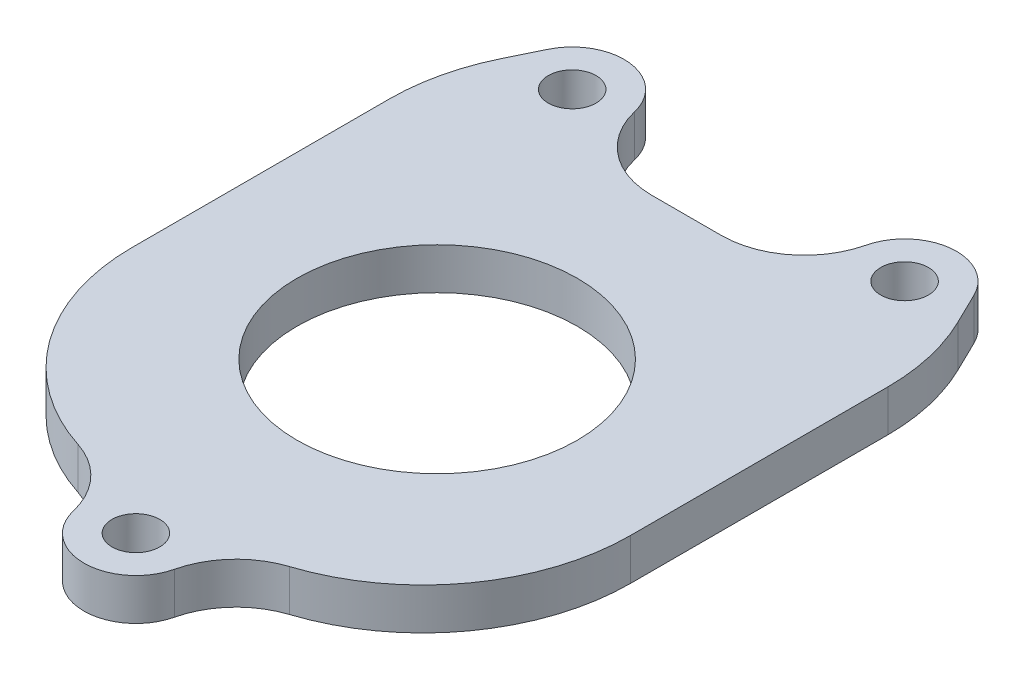
from build123d import *

# Parameters (mm, degrees)
SKETCH_1_W          = 24
SKETCH_1_H          = 24
EXTRUDE_1_DEPTH     = 2
SKETCH_2_R          = 1.15
EXTRUDE_2_DEPTH     = 2
FILLET_1_R          = 10
SKETCH_3_R          = 6.75
CUT_EXTRUDE_1_DEPTH = 2
FILLET_2_R          = 10


with BuildPart() as part:
    # Эскиз1 → Бобышка-Вытянуть1 (new body)
    with BuildSketch(Plane(origin=(0, 0, 0), x_dir=(1, 0, 0), z_dir=(0, 1, 0))):
        Rectangle(SKETCH_1_W, SKETCH_1_H)
    extrude(amount=EXTRUDE_1_DEPTH)

    # Эскиз2 → Бобышка-Вытянуть2 (add)
    # profile 1 of 3: a face of its own
    with BuildSketch(Plane(origin=(0, 2, 0), x_dir=(1, 0, 0), z_dir=(0, 1, 0))):
        with BuildLine():
            Line((-6.32455532, -12), (6.32455532, -12))
            ThreePointArc((6.32455532, -12), (3.843860629, -12.862141838), (2.432521277, -15.076923077))
            ThreePointArc((2.432521277, -15.076923077), (0, -17), (-2.432521277, -15.076923077))
            ThreePointArc((-2.432521277, -15.076923077), (-3.843860629, -12.862141838), (-6.32455532, -12))
        make_face()
        with Locations(Location((0, -14.5, 0), (0, 0, 270))):
            Circle(SKETCH_2_R, mode=Mode.SUBTRACT)
    # profile 2 of 3: a face of its own
    with BuildSketch(Plane(origin=(0, 2, 0), x_dir=(1, 0, 0), z_dir=(0, 1, 0))):
        with BuildLine():
            Line((-12, 12), (-10.247191011, 15.595505618))
            ThreePointArc((-10.247191011, 15.595505618), (-7.72464788, 16.984789973), (-5.567478723, 15.076923077))
            ThreePointArc((-5.567478723, 15.076923077), (-4.156139371, 12.862141838), (-1.67544468, 12))
            Line((-1.67544468, 12), (-12, 12))
        make_face()
        with Locations(Location((-8, 14.5, 0), (0, 0, 270))):
            Circle(SKETCH_2_R, mode=Mode.SUBTRACT)
    # profile 3 of 3: a face of its own
    with BuildSketch(Plane(origin=(0, 2, 0), x_dir=(1, 0, 0), z_dir=(0, 1, 0))):
        with BuildLine():
            Line((12, 12), (1.67544468, 12))
            ThreePointArc((1.67544468, 12), (4.156139371, 12.862141838), (5.567478723, 15.076923077))
            ThreePointArc((5.567478723, 15.076923077), (7.72464788, 16.984789973), (10.247191011, 15.595505618))
            Line((10.247191011, 15.595505618), (12, 12))
        make_face()
        with Locations(Location((8, 14.5, 0), (0, 0, 90))):
            Circle(SKETCH_2_R, mode=Mode.SUBTRACT)
    extrude(amount=-EXTRUDE_2_DEPTH)

    # Скругление1
    fillet_1_edges = [part.edges().sort_by_distance(p)[0] for p in [
        (12, 1, 12),
        (-12, 1, 12),
    ]]
    fillet(fillet_1_edges, radius=FILLET_1_R)

    # Эскиз3 → Вырез-Вытянуть1 (cut)
    with BuildSketch(Plane(origin=(0, 2, 0), x_dir=(1, 0, 0), z_dir=(0, 1, 0))):
        with Locations(Location((0, 0, 0), (0, 0, 270))):
            Circle(SKETCH_3_R)
    extrude(amount=-CUT_EXTRUDE_1_DEPTH, mode=Mode.SUBTRACT)

    # Скругление2
    fillet_2_edges = [part.edges().sort_by_distance(p)[0] for p in [
        (-12, 1, -12),
        (12, 1, -12),
    ]]
    fillet(fillet_2_edges, radius=FILLET_2_R)


solid = part.part
